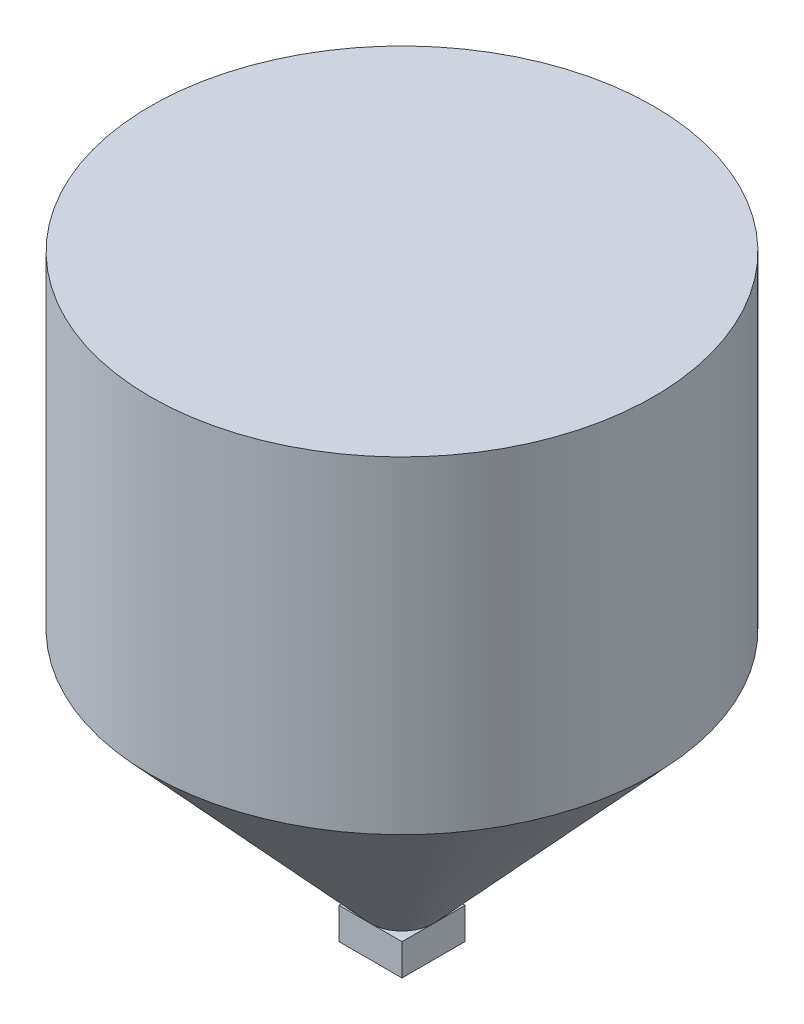
from build123d import *

# Parameters (mm, degrees)
CROQUIS1_R              = 400
SALIENTE_EXTRUIR1_DEPTH = 520
CROQUIS3_R              = 50
CROQUIS2_R              = 400
CROQUIS4_W              = 100
CROQUIS4_H              = 100
SALIENTE_EXTRUIR2_DEPTH = 50


with BuildPart() as part:
    # Croquis1 → Saliente-Extruir1 (new body)
    with BuildSketch(Plane(origin=(0, 0, 0), x_dir=(1, 0, 0), z_dir=(0, 1, 0))):
        with Locations(Location((0, 0, 0), (0, 0, 270))):
            Circle(CROQUIS1_R)
    extrude(amount=-SALIENTE_EXTRUIR1_DEPTH)

    # Croquis3 → Recubrir1 section 0
    with BuildSketch(Plane(origin=(0, -900, 0), x_dir=(1, 0, 0), z_dir=(0, 1, 0))):
        Circle(CROQUIS3_R)
    # Croquis2 → Recubrir1 section 1
    with BuildSketch(Plane.XZ.offset(520)):
        Circle(CROQUIS2_R)
    loft()

    # Croquis4 → Saliente-Extruir2 (add)
    with BuildSketch(Plane.XZ.offset(900)):
        Rectangle(CROQUIS4_W, CROQUIS4_H)
    extrude(amount=SALIENTE_EXTRUIR2_DEPTH)


solid = part.part
